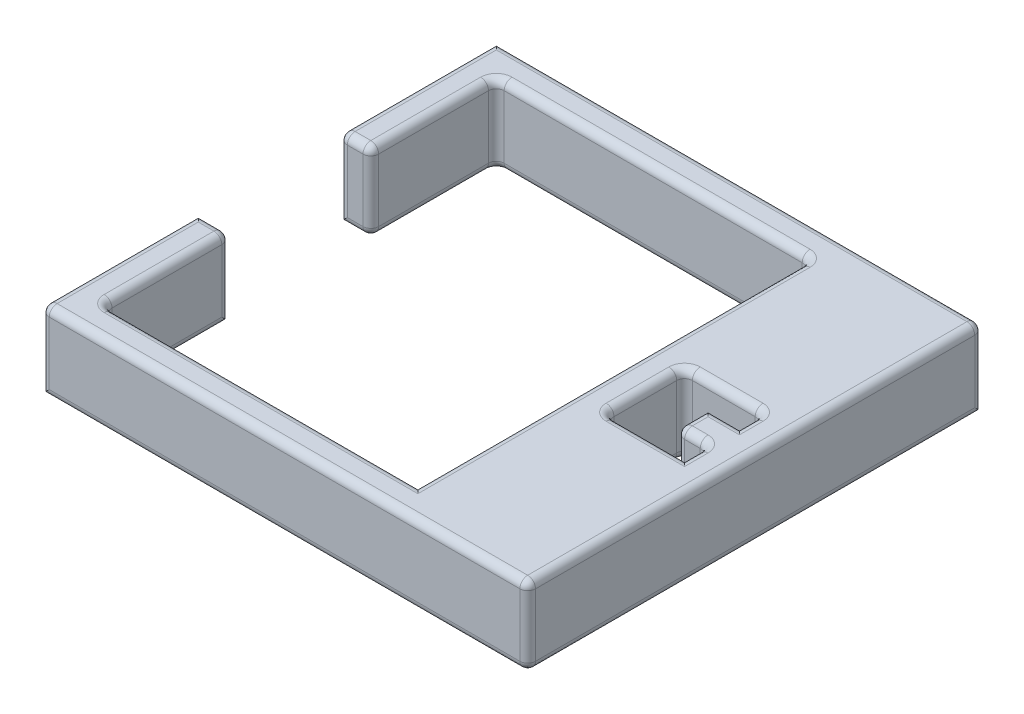
from build123d import *

# Parameters (mm, degrees)
BOSS_EXTRUDE2_DEPTH = 5
FILLET1_R           = 0.5


with BuildPart() as part:
    # Sketch1 → Boss-Extrude2 (new body)
    with BuildSketch(Plane(origin=(0, 0, 0), x_dir=(1, 0, 0), z_dir=(0, 1, 0))):
        Polygon((46.062322946, -39.44276686), (15.062322946, -39.44276686), (15.062322946, -49.44276686), (17.062322946, -49.44276686), (17.062322946, -41.44276686), (37.062322946, -41.44276686), (37.062322946, -66.44276686), (17.062322946, -66.44276686), (17.062322946, -58.44276686), (15.062322946, -58.44276686), (15.062322946, -68.44276686), (46.062322946, -68.44276686), align=None)
        Polygon((44.062322946, -56.44276686), (39.062322946, -56.44276686), (39.062322946, -51.44276686), (44.062322946, -51.44276686), (44.062322946, -52.94276686), (42.062322946, -52.94276686), (42.062322946, -54.94276686), (44.062322946, -54.94276686), align=None, mode=Mode.SUBTRACT)
    extrude(amount=BOSS_EXTRUDE2_DEPTH)

    # Fillet1
    fillet1_edges = [part.edges().sort_by_distance(p)[0] for p in [
        (41.562322946, 5, 51.44276686),
        (44.062322946, 5, 52.19276686),
        (16.062322946, 0, 49.44276686),
        (43.062322946, 5, 52.94276686),
        (46.062322946, 0, 53.94276686),
        (30.562322946, 0, 68.44276686),
        (17.062322946, 0, 62.44276686),
        (27.062322946, 0, 66.44276686),
        (37.062322946, 0, 53.94276686),
        (42.062322946, 5, 53.94276686),
        (27.062322946, 0, 41.44276686),
        (17.062322946, 0, 45.44276686),
        (44.062322946, 0, 52.19276686),
        (41.562322946, 0, 51.44276686),
        (39.062322946, 0, 53.94276686),
        (41.562322946, 0, 56.44276686),
        (17.062322946, 2.5, 49.44276686),
        (15.062322946, 2.5, 49.44276686),
        (46.062322946, 2.5, 39.44276686),
        (46.062322946, 2.5, 68.44276686),
        (15.062322946, 2.5, 68.44276686),
        (17.062322946, 2.5, 58.44276686),
        (17.062322946, 2.5, 66.44276686),
        (37.062322946, 2.5, 41.44276686),
        (17.062322946, 5, 45.44276686),
        (17.062322946, 2.5, 41.44276686),
        (44.062322946, 2.5, 51.44276686),
        (39.062322946, 2.5, 51.44276686),
        (39.062322946, 2.5, 56.44276686),
        (27.062322946, 5, 41.44276686),
        (37.062322946, 5, 53.94276686),
        (41.562322946, 5, 56.44276686),
        (27.062322946, 5, 66.44276686),
        (44.062322946, 0, 55.69276686),
        (44.062322946, 5, 55.69276686),
        (17.062322946, 5, 62.44276686),
        (44.062322946, 2.5, 54.94276686),
        (16.062322946, 5, 58.44276686),
        (15.062322946, 5, 63.44276686),
        (42.062322946, 2.5, 54.94276686),
        (43.062322946, 5, 54.94276686),
        (43.062322946, 0, 54.94276686),
        (30.562322946, 5, 68.44276686),
        (46.062322946, 5, 53.94276686),
        (30.562322946, 5, 39.44276686),
        (39.062322946, 5, 53.94276686),
        (15.062322946, 5, 44.44276686),
        (16.062322946, 5, 49.44276686),
    ]]
    fillet(fillet1_edges, radius=FILLET1_R)


solid = part.part
